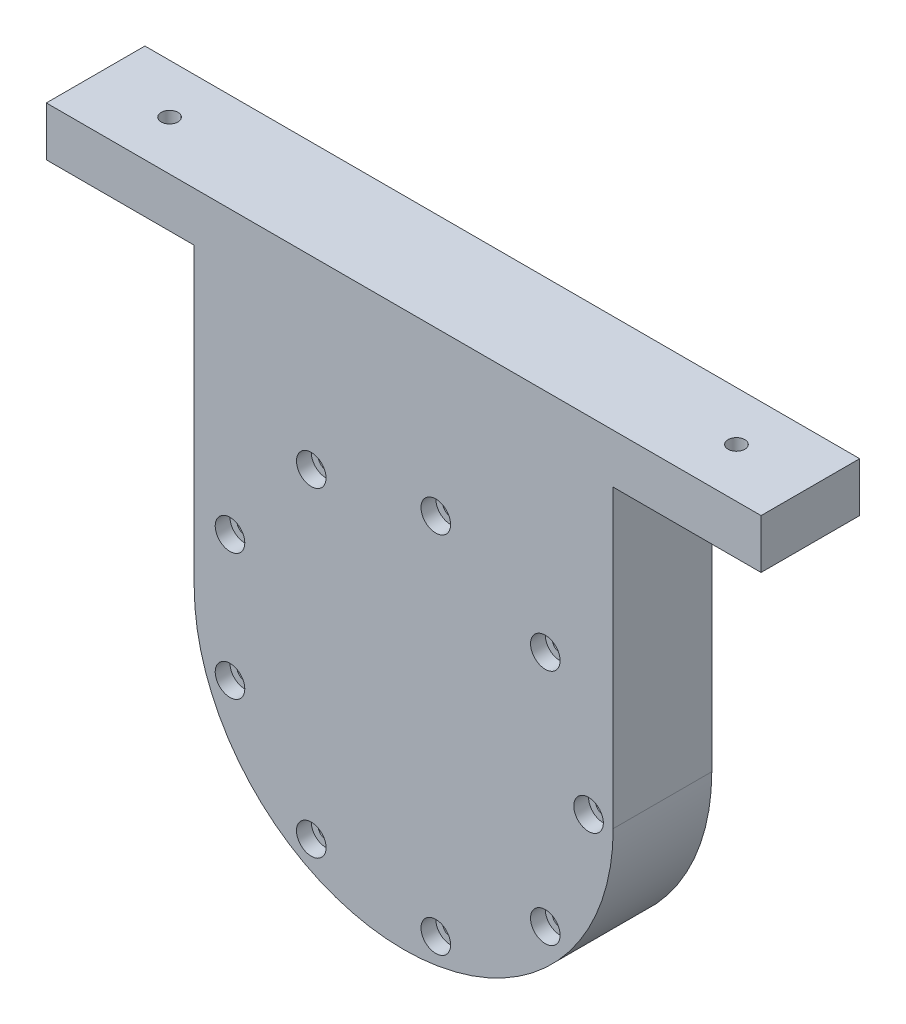
from build123d import *

# Parameters (mm, degrees)
SKETCH1_R           = 1.6
BOSS_EXTRUDE2_DEPTH = 20
SKETCH2_R           = 3
CUT_EXTRUDE1_DEPTH  = 3
SKETCH3_R           = 1.7
CUT_EXTRUDE2_DEPTH  = 128.131821351


with BuildPart() as part:
    # Sketch1 → Boss-Extrude2 (new body)
    with BuildSketch(Plane.XY):
        with BuildLine():
            Line((-42.5, 0), (-42.5, 60))
            Line((-42.5, 60), (-72.5, 60))
            Line((-72.5, 60), (-72.5, 70))
            Line((-72.5, 70), (72.5, 70))
            Line((72.5, 70), (72.5, 60))
            Line((72.5, 60), (42.5, 60))
            Line((42.5, 60), (42.5, 0))
            ThreePointArc((42.5, 0), (0, -42.5), (-42.5, 0))
        make_face()
        with Locations((37.5, 0)):
            Circle(SKETCH1_R, mode=Mode.SUBTRACT)
        with Locations((28.726666617, -24.104535363)):
            Circle(SKETCH1_R, mode=Mode.SUBTRACT)
        with Locations((6.511806663, -36.930290738)):
            Circle(SKETCH1_R, mode=Mode.SUBTRACT)
        with Locations((-18.75, -32.475952642)):
            Circle(SKETCH1_R, mode=Mode.SUBTRACT)
        with Locations((-35.238473279, -12.825755375)):
            Circle(SKETCH1_R, mode=Mode.SUBTRACT)
        with Locations((-35.238473279, 12.825755375)):
            Circle(SKETCH1_R, mode=Mode.SUBTRACT)
        with Locations((-18.75, 32.475952642)):
            Circle(SKETCH1_R, mode=Mode.SUBTRACT)
        with Locations((6.511806663, 36.930290738)):
            Circle(SKETCH1_R, mode=Mode.SUBTRACT)
        with Locations((28.726666617, 24.104535363)):
            Circle(SKETCH1_R, mode=Mode.SUBTRACT)
    extrude(amount=BOSS_EXTRUDE2_DEPTH)

    # Sketch2 → Cut-Extrude1 (cut)
    with BuildSketch(Plane.XY.offset(20)):
        with Locations((6.511806663, 36.930290738)):
            Circle(SKETCH2_R)
        with Locations((28.726666617, 24.104535363)):
            Circle(SKETCH2_R)
        with Locations((37.5, 0)):
            Circle(SKETCH2_R)
        with Locations((28.726666617, -24.104535363)):
            Circle(SKETCH2_R)
        with Locations((6.511806663, -36.930290738)):
            Circle(SKETCH2_R)
        with Locations((-18.75, -32.475952642)):
            Circle(SKETCH2_R)
        with Locations((-35.238473279, -12.825755375)):
            Circle(SKETCH2_R)
        with Locations((-35.238473279, 12.825755375)):
            Circle(SKETCH2_R)
        with Locations((-18.75, 32.475952642)):
            Circle(SKETCH2_R)
    extrude(amount=-CUT_EXTRUDE1_DEPTH, mode=Mode.SUBTRACT)

    # Sketch3 → Cut-Extrude2 (cut, through all)
    with BuildSketch(Plane.XZ.offset(-60)):
        with Locations(Location((57.5, 10, 0), (0, 0, 270))):
            Circle(SKETCH3_R)
        with Locations(Location((-57.5, 10, 0), (0, 0, 270))):
            Circle(SKETCH3_R)
    extrude(amount=-CUT_EXTRUDE2_DEPTH, mode=Mode.SUBTRACT)


solid = part.part
